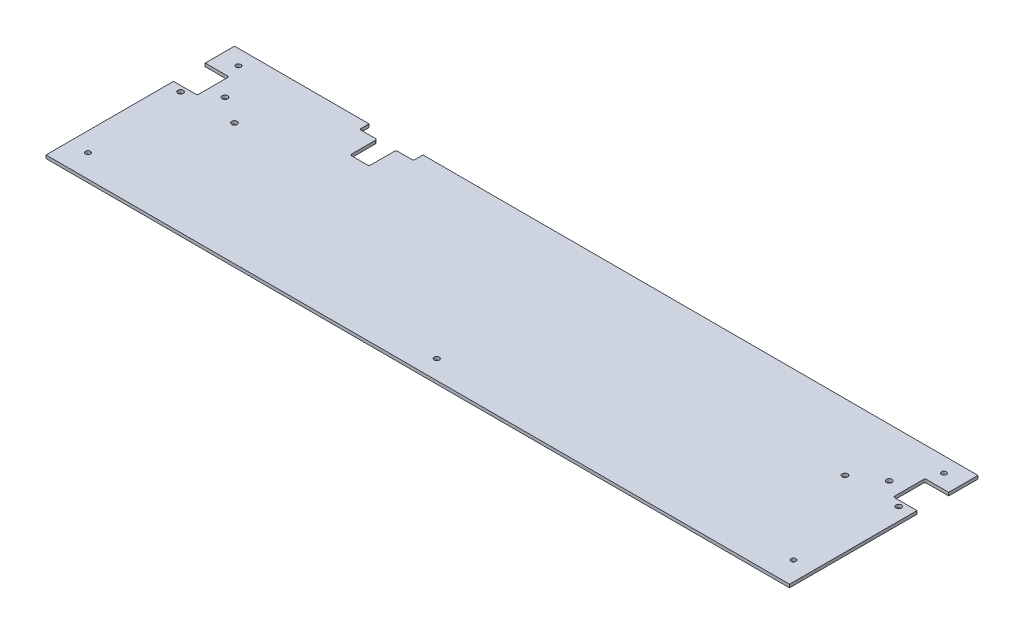
from build123d import *

# Parameters (mm, degrees)
CROQUIS1_W              = 470.5
CROQUIS1_H              = 120
CROQUIS1_R              = 1.55
SALIENTE_EXTRUIR1_DEPTH = 2
CROQUIS2_W              = 470.5
CROQUIS2_H              = 120
CROQUIS2_W_2            = 469.5
CROQUIS2_H_2            = 119
CORTAR_EXTRUIR1_DEPTH   = 2
CORTAR_EXTRUIR2_DEPTH   = 2
REDONDEO1_R             = 1
CROQUIS4_R              = 1.6
CORTAR_EXTRUIR3_DEPTH   = 2
CROQUIS5_R              = 1.75
CORTAR_EXTRUIR4_DEPTH   = 2
CROQUIS6_W              = 15
CROQUIS6_H              = 20
CORTAR_EXTRUIR5_DEPTH   = 2
REDONDEO2_R             = 1


with BuildPart() as part:
    # Croquis1 → Saliente-Extruir1 (new body)
    with BuildSketch(Plane(origin=(0, 0, 0), x_dir=(1, 0, 0), z_dir=(0, 1, 0))):
        with Locations((235.25, 60)):
            Rectangle(CROQUIS1_W, CROQUIS1_H)
        with Locations(Location((12.5, 15, 0), (0, 0, 270))):
            Circle(CROQUIS1_R, mode=Mode.SUBTRACT)
        with Locations(Location((12.5, 110, 0), (0, 0, 270))):
            Circle(CROQUIS1_R, mode=Mode.SUBTRACT)
        with Locations(Location((458, 15, 0), (0, 0, 90))):
            Circle(CROQUIS1_R, mode=Mode.SUBTRACT)
        with Locations(Location((458, 110, 0), (0, 0, 90))):
            Circle(CROQUIS1_R, mode=Mode.SUBTRACT)
    extrude(amount=SALIENTE_EXTRUIR1_DEPTH)

    # Croquis2 → Cortar-Extruir1 (cut)
    with BuildSketch(Plane.XZ):
        with Locations((235.25, -60)):
            Rectangle(CROQUIS2_W, CROQUIS2_H)
        with Locations((235.25, -60)):
            Rectangle(CROQUIS2_W_2, CROQUIS2_H_2, mode=Mode.SUBTRACT)
    extrude(amount=-CORTAR_EXTRUIR1_DEPTH, mode=Mode.SUBTRACT)

    # Croquis3 → Cortar-Extruir2 (cut)
    with BuildSketch(Plane.XZ):
        Polygon((85.5, -119.5), (119.5, -119.5), (119.5, -113.5), (108.5, -113.5), (108.5, -96.5), (96.5, -96.5), (96.5, -113.5), (85.5, -113.5), align=None)
    extrude(amount=-CORTAR_EXTRUIR2_DEPTH, mode=Mode.SUBTRACT)

    # Redondeo1
    redondeo1_edges = [part.edges().sort_by_distance(p)[0] for p in [
        (85.5, 1, -113.5),
        (96.5, 1, -113.5),
        (96.5, 1, -96.5),
        (108.5, 1, -96.5),
        (108.5, 1, -113.5),
        (119.5, 1, -113.5),
    ]]
    fillet(redondeo1_edges, radius=REDONDEO1_R)

    # Croquis4 → Cortar-Extruir3 (cut)
    with BuildSketch(Plane.XZ):
        with Locations(Location((235.25, -12.5, 0), (0, 0, 270))):
            Circle(CROQUIS4_R)
    extrude(amount=-CORTAR_EXTRUIR3_DEPTH, mode=Mode.SUBTRACT)

    # Croquis5 → Cortar-Extruir4 (cut)
    with BuildSketch(Plane.XZ):
        with Locations(Location((8.5, -77.5, 0), (0, 0, 270))):
            Circle(CROQUIS5_R)
        with Locations(Location((42.5, -77.5, 0), (0, 0, 270))):
            Circle(CROQUIS5_R)
        with Locations(Location((25.5, -88.5, 0), (0, 0, 270))):
            Circle(CROQUIS5_R)
        with Locations(Location((462, -77.5, 0), (0, 0, 270))):
            Circle(CROQUIS5_R)
        with Locations(Location((428, -77.5, 0), (0, 0, 270))):
            Circle(CROQUIS5_R)
        with Locations(Location((445, -88.5, 0), (0, 0, 270))):
            Circle(CROQUIS5_R)
    extrude(amount=-CORTAR_EXTRUIR4_DEPTH, mode=Mode.SUBTRACT)

    # Croquis6 → Cortar-Extruir5 (cut)
    with BuildSketch(Plane.XZ):
        with Locations((8, -91)):
            Rectangle(CROQUIS6_W, CROQUIS6_H)
        with Locations((462.5, -91)):
            Rectangle(CROQUIS6_W, CROQUIS6_H)
    extrude(amount=-CORTAR_EXTRUIR5_DEPTH, mode=Mode.SUBTRACT)

    # Redondeo2
    redondeo2_edges = [part.edges().sort_by_distance(p)[0] for p in [
        (15.5, 1, -81),
        (15.5, 1, -101),
        (455, 1, -81),
        (455, 1, -101),
    ]]
    fillet(redondeo2_edges, radius=REDONDEO2_R)


solid = part.part
